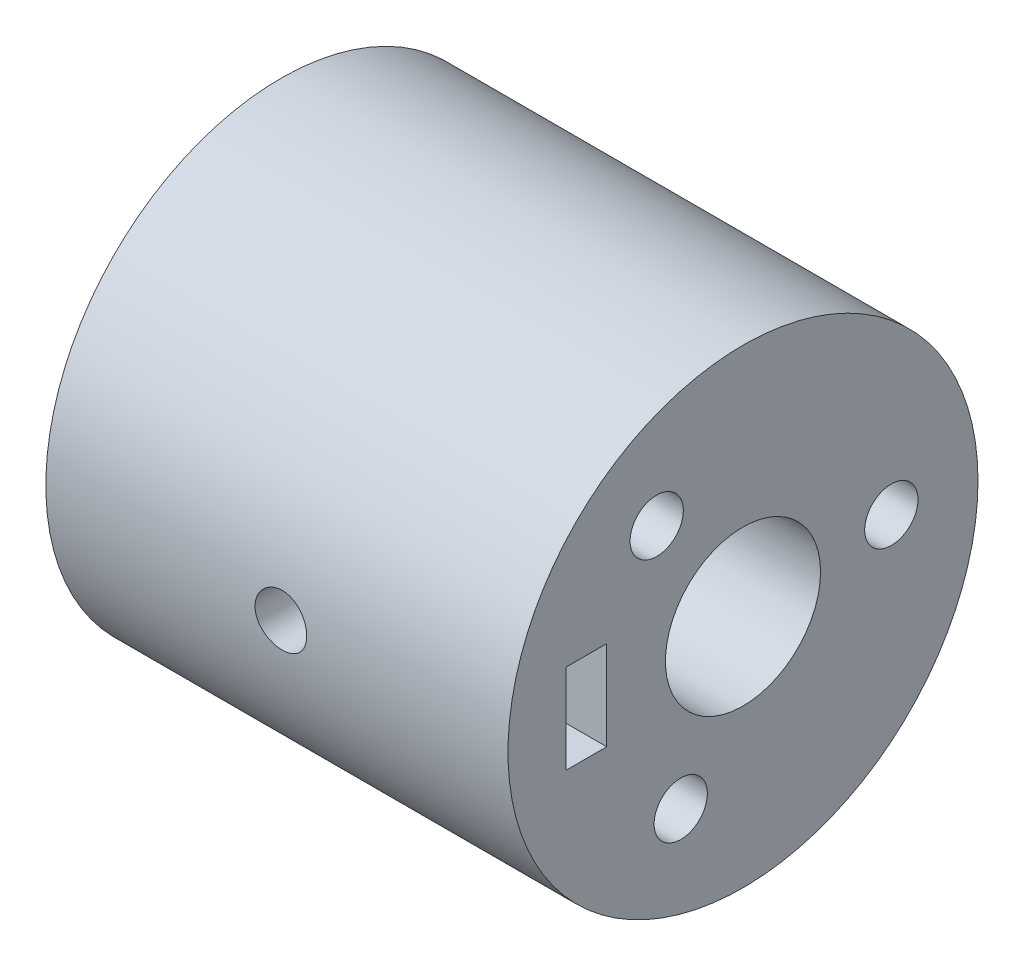
from build123d import *

# Parameters (mm, degrees)
SKETCH1_R               = 15
BOSS_EXTRUDE1_DEPTH     = 29.5
SKETCH2_R               = 4.95
SKETCH2_R_2             = 1.7
CUT_EXTRUDE1_DEPTH      = 34
SKETCH3_R               = 1.65
CUT_EXTRUDE2_DEPTH      = 12
CUT_EXTRUDE3_DEPTH      = 1.3
CUT_EXTRUDE3_DEPTH_BACK = 1.3
SKETCH5_W               = 5.7
SKETCH5_H               = 2.6
CUT_EXTRUDE4_DEPTH      = 16


with BuildPart() as part:
    # Sketch1 → Boss-Extrude1 (new body)
    with BuildSketch(Plane.YZ):
        Circle(SKETCH1_R)
    extrude(amount=BOSS_EXTRUDE1_DEPTH)

    # Sketch2 → Cut-Extrude1 (cut)
    with BuildSketch(Plane.YZ.offset(29.5)):
        Circle(SKETCH2_R)
        with Locations((-8.639482257, 3.974851738)):
            Circle(SKETCH2_R_2)
        with Locations((7.768907949, 5.509495297)):
            Circle(SKETCH2_R_2)
        with Locations((0.893753154, -9.467909236)):
            Circle(SKETCH2_R_2)
    extrude(amount=-CUT_EXTRUDE1_DEPTH, mode=Mode.SUBTRACT)

    # Sketch3 → Cut-Extrude2 (cut)
    with BuildSketch(Plane(origin=(0, 0, 15), x_dir=(0, 1, 0), z_dir=(0, 0, 1))):
        with Locations((0, -15)):
            Circle(SKETCH3_R)
    extrude(amount=-CUT_EXTRUDE2_DEPTH, mode=Mode.SUBTRACT)

    # Sketch4 → Cut-Extrude3 (cut, two sides: drawn at the far end of the back side and taken through both)
    with BuildSketch(Plane(origin=(0, 0, 10), x_dir=(0, 1, 0), z_dir=(0, 0, 1)).offset(-CUT_EXTRUDE3_DEPTH_BACK)):
        Polygon((-2.85, -16.645448267), (0, -18.290896534), (2.85, -16.645448267), (2.85, -13.354551733), (0, -11.709103466), (-2.85, -13.354551733), align=None)
    extrude(amount=CUT_EXTRUDE3_DEPTH + CUT_EXTRUDE3_DEPTH_BACK, mode=Mode.SUBTRACT)

    # Sketch5 → Cut-Extrude4 (cut)
    with BuildSketch(Plane.YZ.offset(29.5)):
        with Locations((0, 10)):
            Rectangle(SKETCH5_W, SKETCH5_H)
    extrude(amount=-CUT_EXTRUDE4_DEPTH, mode=Mode.SUBTRACT)


solid = part.part
